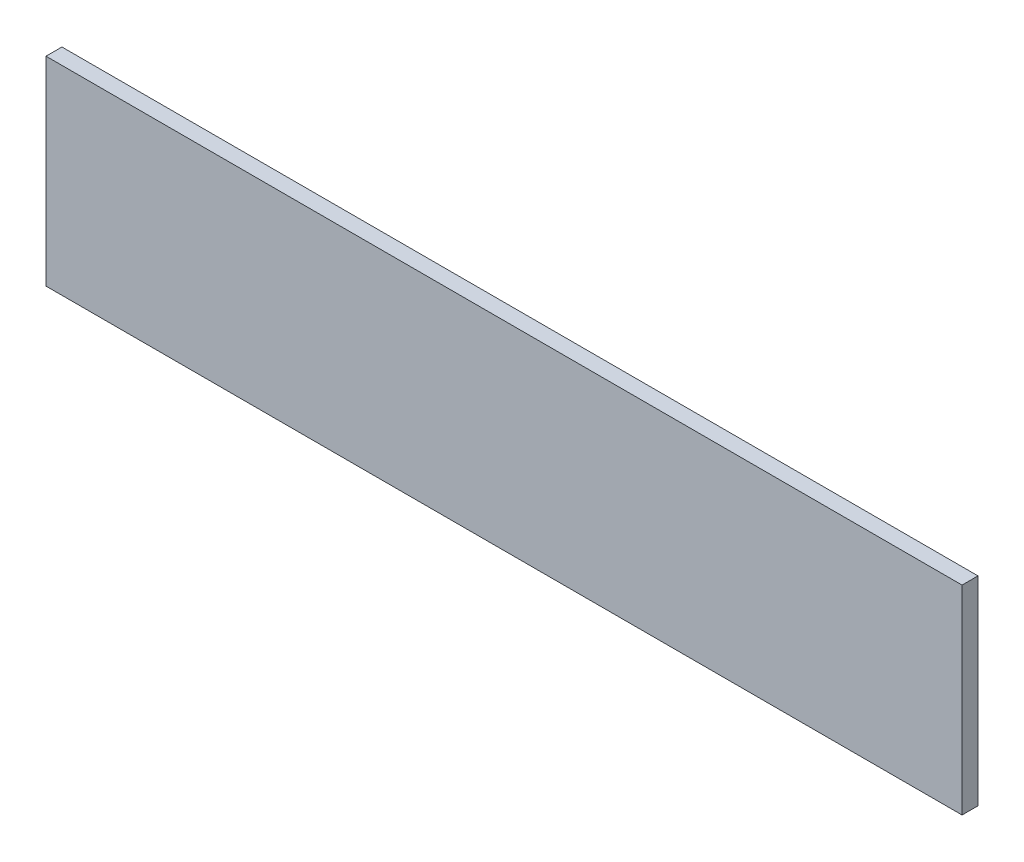
from build123d import *

# Parameters (mm, degrees)
SKETCH1_W           = 230
SKETCH1_H           = 50
BOSS_EXTRUDE1_DEPTH = 4


with BuildPart() as part:
    # Sketch1 → Boss-Extrude1 (new body)
    with BuildSketch(Plane.XY):
        with Locations((115, 25)):
            Rectangle(SKETCH1_W, SKETCH1_H)
    extrude(amount=BOSS_EXTRUDE1_DEPTH)


solid = part.part
